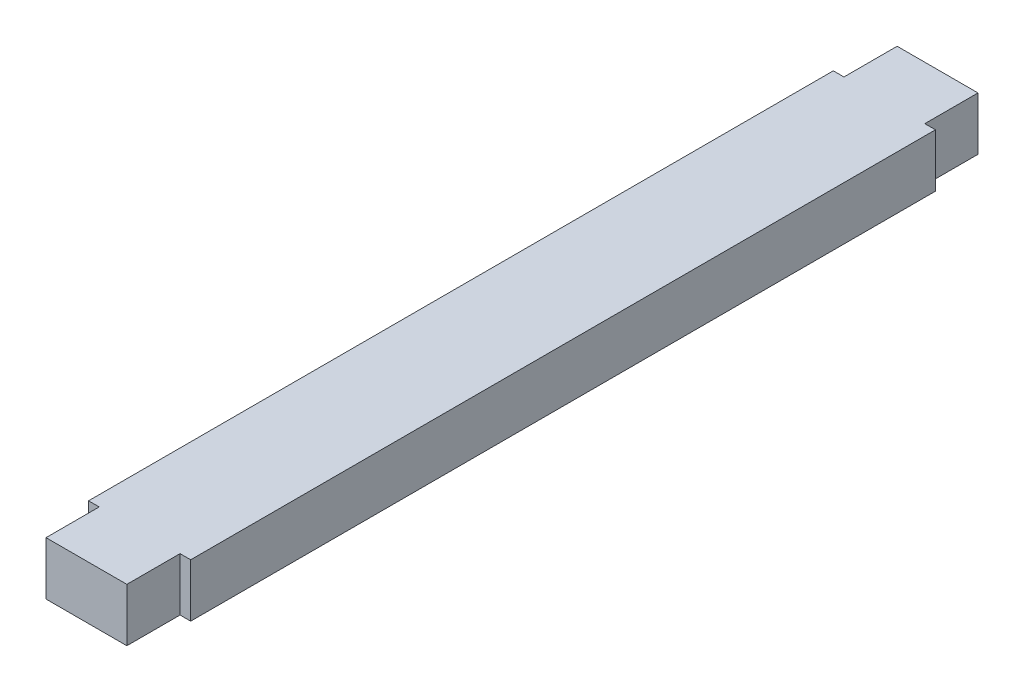
from build123d import *

# Parameters (mm, degrees)
BOSS_EXTRUDE1_DEPTH = 6.35


with BuildPart() as part:
    # Sketch1 → Boss-Extrude1 (new body)
    with BuildSketch(Plane(origin=(0, 0, 0), x_dir=(1, 0, 0), z_dir=(0, 1, 0))):
        Polygon((0, 0), (0, 17.78), (-1.27, 17.78), (-1.27, 24.13), (-10.922, 24.13), (-10.922, 17.78), (-12.192, 17.78), (-12.192, 0), (-12.192, -53.34), (-12.192, -71.12), (-10.922, -71.12), (-10.922, -77.47), (-1.27, -77.47), (-1.27, -71.12), (0, -71.12), (0, -53.34), align=None)
    extrude(amount=BOSS_EXTRUDE1_DEPTH)


solid = part.part
